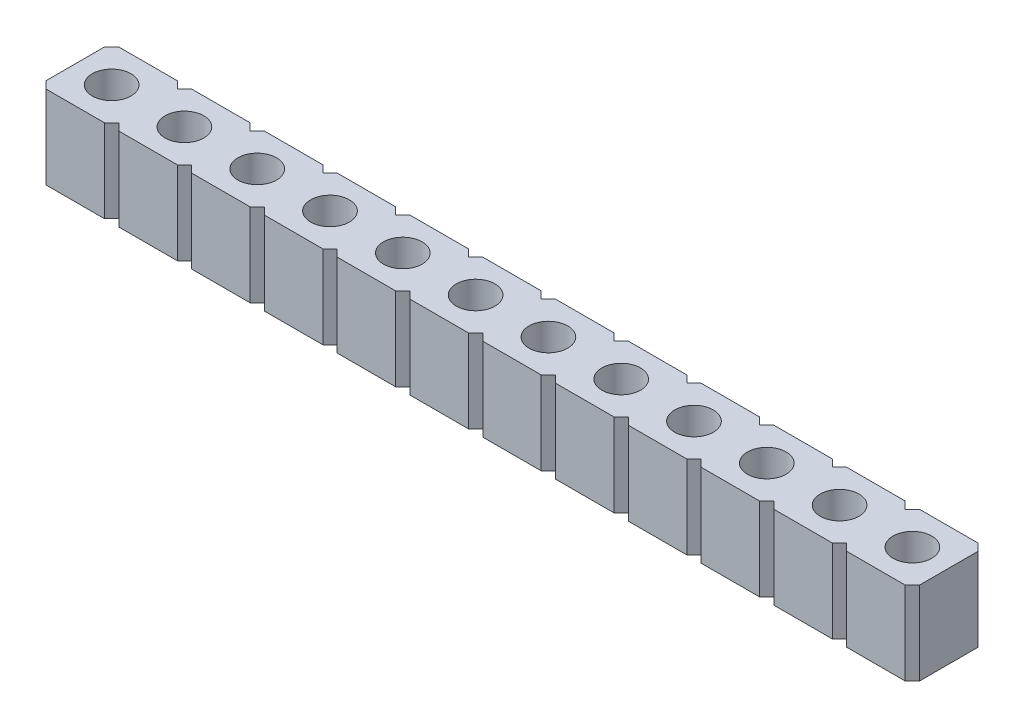
from build123d import *

# Parameters (mm, degrees)
BOSS_EXTRUDE1_DEPTH = 2.9
SKETCH3_R           = 0.675
CUT_EXTRUDE1_DEPTH  = 3
LPATTERN1_COUNT     = 12
LPATTERN1_PITCH     = 2.54


with BuildPart() as part:
    # Sketch2 → Boss-Extrude1 (new body)
    with BuildSketch(Plane(origin=(0, 0, 0), x_dir=(1, 0, 0), z_dir=(0, 1, 0))):
        Polygon((-1.02, 1.27), (1.02, 1.27), (1.27, 1.02), (1.27, -1.02), (1.02, -1.27), (-1.02, -1.27), (-1.27, -1.02), (-1.27, 1.02), align=None)
    boss_extrude1 = extrude(amount=BOSS_EXTRUDE1_DEPTH)

    # Sketch3 → Cut-Extrude1 (cut)
    with BuildSketch(Plane(origin=(0, 2.9, 0), x_dir=(1, 0, 0), z_dir=(0, 1, 0))):
        with Locations(Location((0, 0, 0), (0, 0, 270))):
            Circle(SKETCH3_R)
    cut_extrude1 = extrude(amount=-CUT_EXTRUDE1_DEPTH, mode=Mode.SUBTRACT)

    # LPattern1: Boss-Extrude1, Cut-Extrude1 ×12
    with Locations(*[(i * LPATTERN1_PITCH, 0, 0) for i in range(1, LPATTERN1_COUNT)]):
        add(boss_extrude1)
        add(cut_extrude1, mode=Mode.SUBTRACT)


solid = part.part
